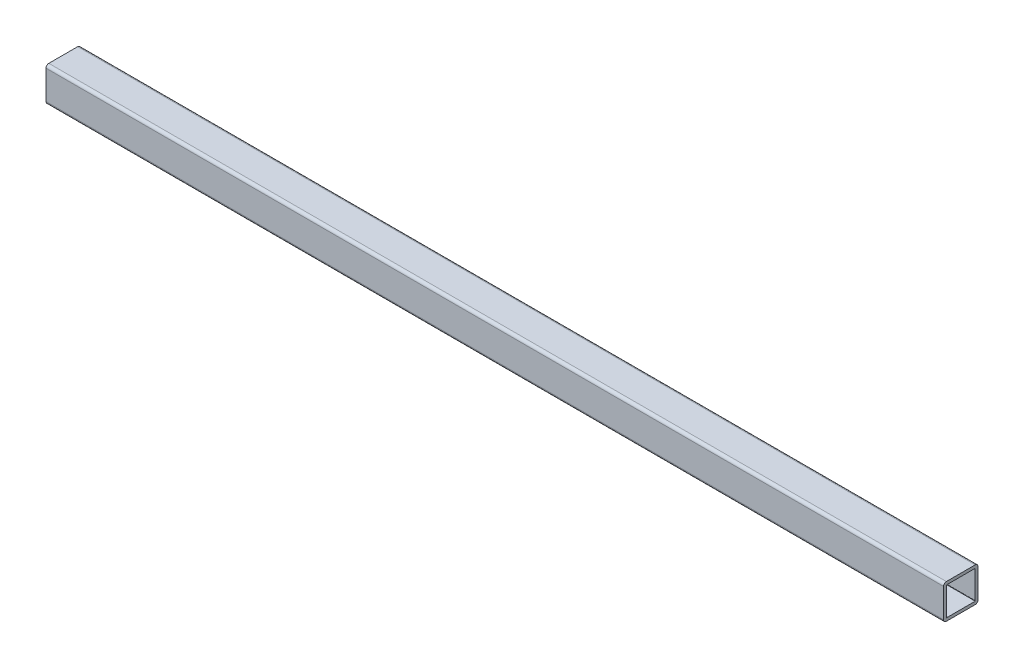
from build123d import *

# Parameters (mm, degrees)
BOSS_EXTRUDE1_DEPTH = 609.6
SCALE1_SCALE_X      = 1
SCALE1_SCALE_Y      = 0.6
SCALE1_SCALE_Z      = 0.6
SKETCH3_W           = 113.540531561
SKETCH3_H           = 19.05
CUT_EXTRUDE2_DEPTH  = 611.426562419


with BuildPart() as part:
    # Sketch1 → Boss-Extrude1 (new body)
    with BuildSketch(Plane(origin=(0, 0, 0), x_dir=(0, 0, -1), z_dir=(1, 0, 0))):
        with BuildLine():
            Line((-0.186356914, 2.58389064), (-0.186356914, 29.16610936))
            ThreePointArc((-0.186356914, 29.16610936), (-0.94316096, 30.993195953), (-2.770247554, 31.75))
            Line((-2.770247554, 31.75), (-29.352466273, 31.75))
            ThreePointArc((-29.352466273, 31.75), (-31.179552867, 30.993195953), (-31.936356914, 29.16610936))
            Line((-31.936356914, 29.16610936), (-31.936356914, 2.58389064))
            ThreePointArc((-31.936356914, 2.58389064), (-31.179552867, 0.756804047), (-29.352466273, 0))
            Line((-29.352466273, 0), (-2.770247554, 0))
            ThreePointArc((-2.770247554, 0), (-0.94316096, 0.756804047), (-0.186356914, 2.58389064))
        make_face()
        with BuildLine():
            Line((-2.93802358, 3.388849212), (-2.93802358, 28.956637898))
            ThreePointArc((-2.93802358, 28.956637898), (-2.83170208, 28.97113344), (-2.727901561, 28.998333333))
            Line((-2.727901561, 28.998333333), (-28.295690247, 28.998333333))
            ThreePointArc((-28.295690247, 28.998333333), (-28.924308175, 28.737951262), (-29.184690247, 28.109333333))
            Line((-29.184690247, 28.109333333), (-29.184690247, 2.541544647))
            ThreePointArc((-29.184690247, 2.541544647), (-28.71113746, 2.523686947), (-28.295690247, 2.751666667))
            Line((-28.295690247, 2.751666667), (-2.727901561, 2.751666667))
            ThreePointArc((-2.727901561, 2.751666667), (-2.770544519, 3.090841377), (-2.93802358, 3.388849212))
        make_face(mode=Mode.SUBTRACT)
    extrude(amount=BOSS_EXTRUDE1_DEPTH)


with BuildPart() as part_1:
    # Scale1: scaled about (304.8, 15.89298345, 16.065667914)
    add(part.part.scale((SCALE1_SCALE_X, SCALE1_SCALE_Y, SCALE1_SCALE_Z), about=(304.8, 15.89298345, 16.065667914)))

    # Sketch3 → Cut-Extrude2 (cut, through all)
    with BuildSketch(Plane.XY.offset(25.588081314)):
        with Locations((552.82973422, 15.88219338)):
            Rectangle(SKETCH3_W, SKETCH3_H)
    extrude(amount=-CUT_EXTRUDE2_DEPTH, mode=Mode.SUBTRACT)


solid = part_1.part
